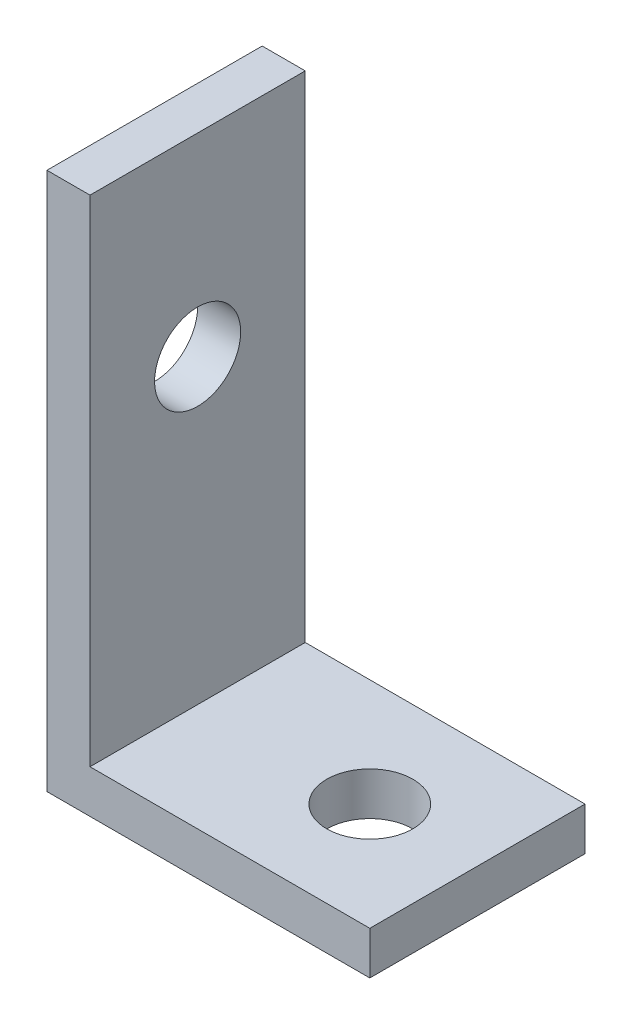
from build123d import *

# Parameters (mm, degrees)
EXTRUDE_1_DEPTH     = 10
SKETCH_2_R          = 2
CUT_EXTRUDE_1_DEPTH = 10
SKETCH_3_R          = 2
CUT_EXTRUDE_2_DEPTH = 10


with BuildPart() as part:
    # 草图1 → 凸台-拉伸1 (new body)
    with BuildSketch(Plane.XY):
        Polygon((0, 0), (0, 25), (2, 25), (2, 2), (15, 2), (15, 0), align=None)
    extrude(amount=EXTRUDE_1_DEPTH)

    # 草图2 → 切除-拉伸1 (cut)
    with BuildSketch(Plane(origin=(0, 2, 0), x_dir=(1, 0, 0), z_dir=(0, 1, 0))):
        with Locations(Location((10, -5, 0), (0, 0, 180))):
            Circle(SKETCH_2_R)
    extrude(amount=-CUT_EXTRUDE_1_DEPTH, mode=Mode.SUBTRACT)

    # 草图3 → 切除-拉伸2 (cut)
    with BuildSketch(Plane(origin=(2, 0, 0), x_dir=(0, 0, -1), z_dir=(1, 0, 0))):
        with Locations(Location((-5, 16, 0), (0, 0, 90))):
            Circle(SKETCH_3_R)
    extrude(amount=-CUT_EXTRUDE_2_DEPTH, mode=Mode.SUBTRACT)


solid = part.part
